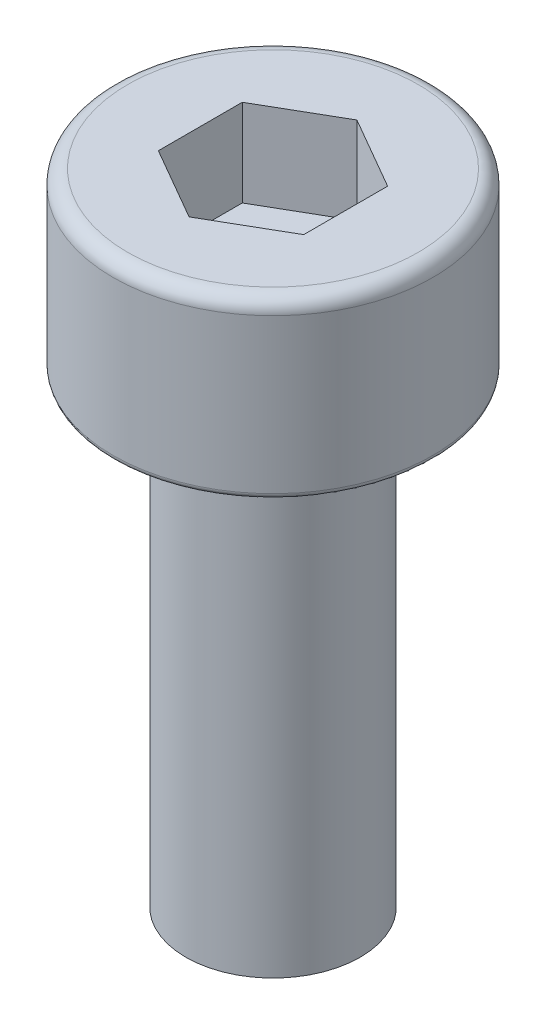
from build123d import *

# Parameters (mm, degrees)
ESBO_O1_R                = 2.75
RESSALTO_EXTRUS_O1_DEPTH = 3
CORTE_EXTRUS_O1_DEPTH    = 1.5
FILETE1_R                = 0.25
FILETE2_R                = 0.1
ESBO_O3_R                = 1.5
RESSALTO_EXTRUS_O2_DEPTH = 8


with BuildPart() as part:
    # Esboço1 → Ressalto-extrusão1 (new body)
    with BuildSketch(Plane(origin=(0, 0, 0), x_dir=(1, 0, 0), z_dir=(0, 1, 0))):
        with Locations(Location((0, 0, 0), (0, 0, 270))):
            Circle(ESBO_O1_R)
    extrude(amount=RESSALTO_EXTRUS_O1_DEPTH)

    # Esboço2 → Corte-extrusão1 (cut)
    with BuildSketch(Plane(origin=(0, 3, 0), x_dir=(1, 0, 0), z_dir=(0, 1, 0))):
        Polygon((0, 1.443375673), (-1.25, 0.721687836), (-1.25, -0.721687836), (0, -1.443375673), (1.25, -0.721687836), (1.25, 0.721687836), align=None)
    extrude(amount=-CORTE_EXTRUS_O1_DEPTH, mode=Mode.SUBTRACT)

    # Filete1
    filete1_edges = [part.edges().sort_by_distance(p)[0] for p in [
        (0, 3, -2.75),
    ]]
    fillet(filete1_edges, radius=FILETE1_R)

    # Filete2
    filete2_edges = [part.edges().sort_by_distance(p)[0] for p in [
        (0, 0, -2.75),
    ]]
    fillet(filete2_edges, radius=FILETE2_R)

    # Esboço3 → Ressalto-extrusão2 (add)
    with BuildSketch(Plane.XZ):
        with Locations(Location((0, 0, 0), (0, 0, 90))):
            Circle(ESBO_O3_R)
    extrude(amount=RESSALTO_EXTRUS_O2_DEPTH)


solid = part.part
